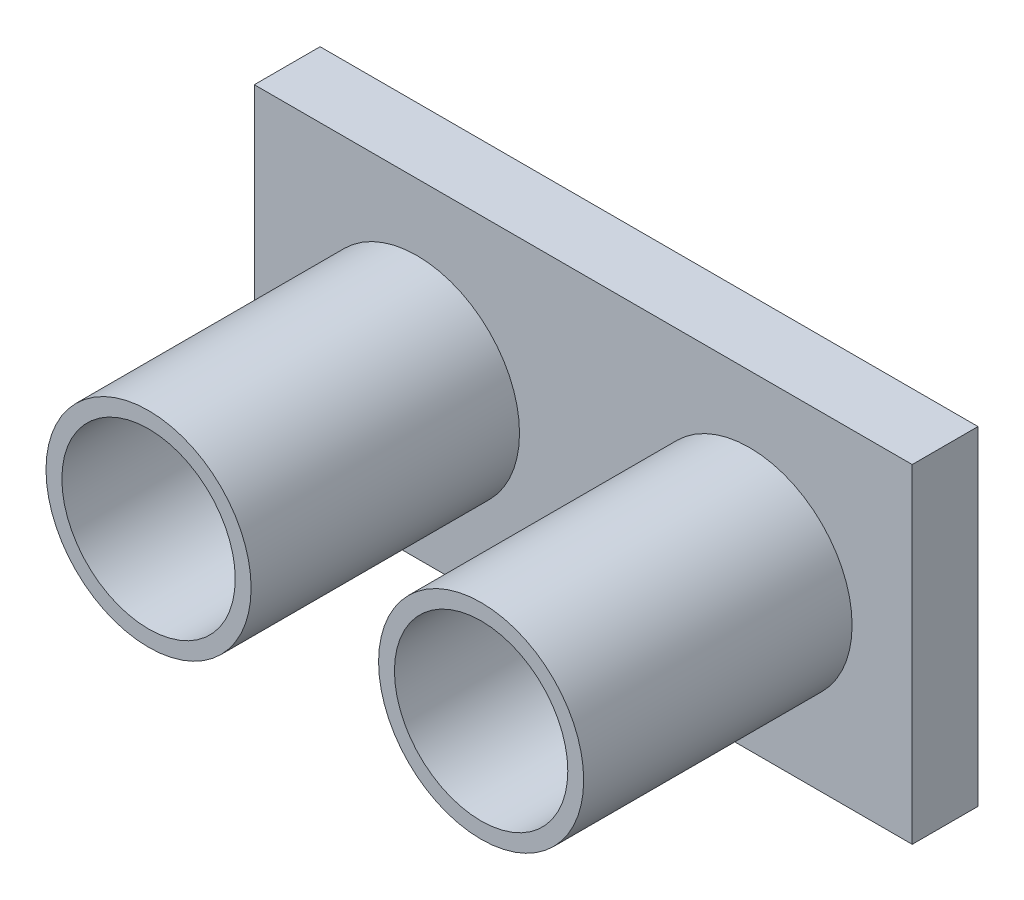
from build123d import *

# Parameters (mm, degrees)
SKETCH1_W           = 100
SKETCH1_H           = 50
BOSS_EXTRUDE1_DEPTH = 10
SKETCH2_R           = 15.587917706
SKETCH2_R_2         = 13.17523912
BOSS_EXTRUDE2_DEPTH = 50.8


with BuildPart() as part:
    # Sketch1 → Boss-Extrude1 (new body)
    with BuildSketch(Plane.XY):
        with Locations((-50, 25)):
            Rectangle(SKETCH1_W, SKETCH1_H)
    extrude(amount=BOSS_EXTRUDE1_DEPTH)

    # Sketch2 → Boss-Extrude2 (add)
    # profile 1 of 2: a face of its own
    with BuildSketch(Plane.XY):
        with Locations((-75.275238724, 24.288037008)):
            Circle(SKETCH2_R)
        with Locations((-75.275238724, 24.288037008)):
            Circle(SKETCH2_R_2, mode=Mode.SUBTRACT)
    # profile 2 of 2: a face of its own
    with BuildSketch(Plane.XY):
        with Locations(Location((-24.724761276, 24.288037008, 0), (0, 0, 180))):
            Circle(SKETCH2_R)
        with Locations(Location((-24.724761276, 24.288037008, 0), (0, 0, 180))):
            Circle(SKETCH2_R_2, mode=Mode.SUBTRACT)
    extrude(amount=BOSS_EXTRUDE2_DEPTH)


solid = part.part
